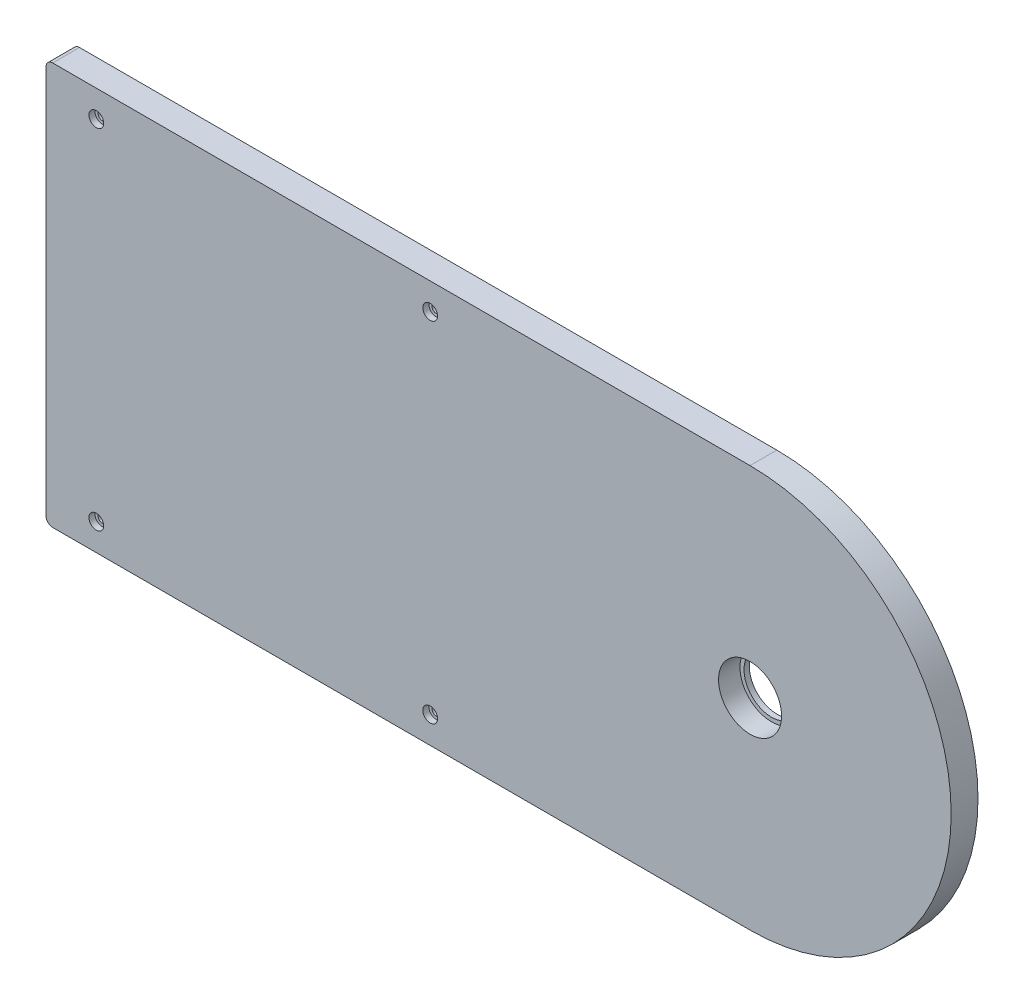
from build123d import *

# Parameters (mm, degrees)
SKETCH1_R           = 20.5
BOSS_EXTRUDE1_DEPTH = 20
SKETCH2_R           = 23.5
CUT_EXTRUDE1_DEPTH  = 16
SKETCH4_W           = 318.75
SKETCH4_H           = 8
BOSS_EXTRUDE2_DEPTH = 3
SKETCH3_R           = 3.25
CUT_EXTRUDE2_DEPTH  = 547.492451915
SKETCH5_R           = 5.5
CUT_EXTRUDE3_DEPTH  = 4.5
FILLET1_R           = 5


with BuildPart() as part:
    # Sketch1 → Boss-Extrude1 (new body)
    with BuildSketch(Plane.XY):
        with BuildLine():
            Line((0, 150), (-525, 150))
            Line((-525, 150), (-525, -150))
            Line((-525, -150), (0, -150))
            ThreePointArc((0, -150), (150, 0), (0, 150))
        make_face()
        Circle(SKETCH1_R, mode=Mode.SUBTRACT)
    extrude(amount=BOSS_EXTRUDE1_DEPTH)

    # Sketch2 → Cut-Extrude1 (cut)
    with BuildSketch(Plane.XY.offset(20)):
        Circle(SKETCH2_R)
    extrude(amount=-CUT_EXTRUDE1_DEPTH, mode=Mode.SUBTRACT)

    # Sketch4 → Boss-Extrude2 (add)
    with BuildSketch(Plane(origin=(0, 0, 0), x_dir=(-1, 0, 0), z_dir=(0, 0, -1))):
        with Locations((365.625, -130)):
            Rectangle(SKETCH4_W, SKETCH4_H)
        with Locations((365.625, 130)):
            Rectangle(SKETCH4_W, SKETCH4_H)
    extrude(amount=BOSS_EXTRUDE2_DEPTH)

    # Sketch3 → Cut-Extrude2 (cut, through all)
    with BuildSketch(Plane.XY.offset(20)):
        with Locations((-238.5, 130)):
            Circle(SKETCH3_R)
        with Locations((-487.5, 130)):
            Circle(SKETCH3_R)
        with Locations((-487.5, -130)):
            Circle(SKETCH3_R)
        with Locations((-238.5, -130)):
            Circle(SKETCH3_R)
    extrude(amount=-CUT_EXTRUDE2_DEPTH, mode=Mode.SUBTRACT)

    # Sketch5 → Cut-Extrude3 (cut)
    with BuildSketch(Plane.XY.offset(20)):
        with Locations((-487.5, 130)):
            Circle(SKETCH5_R)
        with Locations((-238.5, 130)):
            Circle(SKETCH5_R)
        with Locations((-238.5, -130)):
            Circle(SKETCH5_R)
        with Locations((-487.5, -130)):
            Circle(SKETCH5_R)
    extrude(amount=-CUT_EXTRUDE3_DEPTH, mode=Mode.SUBTRACT)

    # Fillet1
    fillet1_edges = [part.edges().sort_by_distance(p)[0] for p in [
        (-525, -150, 10),
        (-525, 150, 10),
    ]]
    fillet(fillet1_edges, radius=FILLET1_R)


solid = part.part
